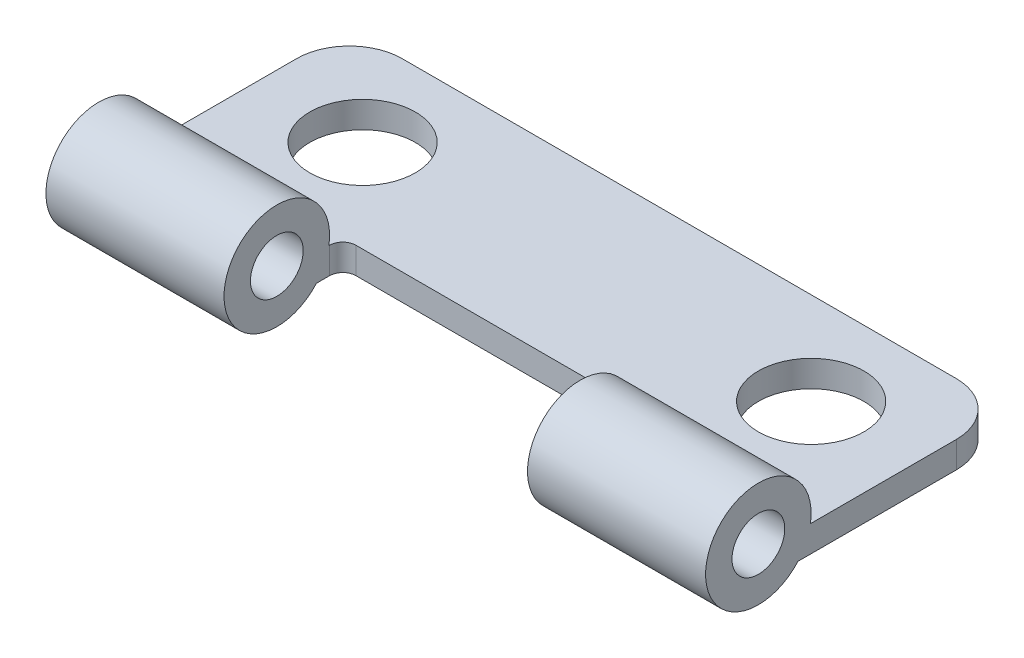
from build123d import *

# Parameters (mm, degrees)
SKETCH_1_R      = 2
EXTRUDE_1_DEPTH = 1
FILLET_1_R      = 2
FILLET_2_R      = 0.5
EXTRUDE_START   = -5.75
SKETCH_2_R      = 2
SKETCH_2_R_2    = 1
EXTRUDE_2_DEPTH = 6.75
EXTRUDE_START_2 = 12.5
SKETCH_2_3_R    = 2
SKETCH_2_3_R_2  = 1
EXTRUDE_3_DEPTH = 6.75


with BuildPart() as part:
    # 草图1 → 凸台-拉伸1 (new body)
    with BuildSketch(Plane(origin=(0, 0, 0), x_dir=(1, 0, 0), z_dir=(0, 1, 0))):
        Polygon((-5.75, 0), (-5.75, 1), (5.75, 1), (5.75, 0), (12.5, 0), (12.5, 1), (12.5, 8), (-12.5, 8), (-12.5, 1), (-12.5, 0), align=None)
        with Locations(Location((-8.5, 4.5, 0), (0, 0, 270))):
            Circle(SKETCH_1_R, mode=Mode.SUBTRACT)
        with Locations(Location((8.5, 4.5, 0), (0, 0, 270))):
            Circle(SKETCH_1_R, mode=Mode.SUBTRACT)
    extrude(amount=EXTRUDE_1_DEPTH)

    # 圆角1
    fillet_1_edges = [part.edges().sort_by_distance(p)[0] for p in [
        (-12.5, 0.5, -8),
        (12.5, 0.5, -8),
    ]]
    fillet(fillet_1_edges, radius=FILLET_1_R)

    # 圆角2
    fillet_2_edges = [part.edges().sort_by_distance(p)[0] for p in [
        (5.75, 0.5, -1),
        (-5.75, 0.5, -1),
    ]]
    fillet(fillet_2_edges, radius=FILLET_2_R)

    # 草图2 → 凸台-拉伸2 (add)
    with BuildSketch(Plane(origin=(0, 0, 0), x_dir=(0, 0, -1), z_dir=(1, 0, 0)).offset(EXTRUDE_START)):
        with Locations((-1.5, 1.322875656)):
            Circle(SKETCH_2_R)
        with Locations((-1.5, 1.322875656)):
            Circle(SKETCH_2_R_2, mode=Mode.SUBTRACT)
    extrude(amount=-EXTRUDE_2_DEPTH)

    # 草图2<3> → 凸台-拉伸3 (add)
    with BuildSketch(Plane(origin=(0, 0, 0), x_dir=(0, 0, -1), z_dir=(1, 0, 0)).offset(EXTRUDE_START_2)):
        with Locations((-1.5, 1.322875656)):
            Circle(SKETCH_2_3_R)
        with Locations((-1.5, 1.322875656)):
            Circle(SKETCH_2_3_R_2, mode=Mode.SUBTRACT)
    extrude(amount=-EXTRUDE_3_DEPTH)


solid = part.part
